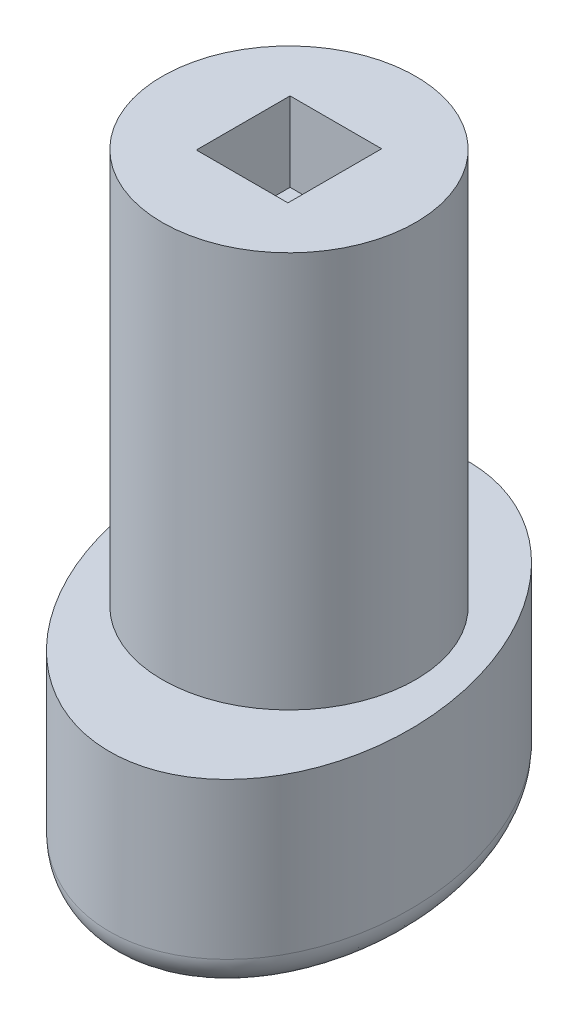
from build123d import *

# Parameters (mm, degrees)
SKETCH1_RX          = 3.556
SKETCH1_RY          = 2.54
BOSS_EXTRUDE1_DEPTH = 3
SKETCH2_R           = 2.032
BOSS_EXTRUDE2_DEPTH = 6.35
SKETCH3_W           = 1.468765614
SKETCH3_H           = 1.503189808
CUT_EXTRUDE1_DEPTH  = 1.27
FILLET1_R           = 0.5


with BuildPart() as part:
    # Sketch1 → Boss-Extrude1 (new body)
    with BuildSketch(Plane(origin=(0, 0, 0), x_dir=(1, 0, 0), z_dir=(0, 1, 0))):
        with Locations(Location((0, 0), (0, 0, 109.894492076))):
            Ellipse(SKETCH1_RX, SKETCH1_RY)
    extrude(amount=BOSS_EXTRUDE1_DEPTH)

    # Sketch2 → Boss-Extrude2 (add)
    with BuildSketch(Plane(origin=(0, 3, 0), x_dir=(1, 0, 0), z_dir=(0, 1, 0))):
        with Locations(Location((0, 0, 0), (0, 0, 270))):
            Circle(SKETCH2_R)
    extrude(amount=BOSS_EXTRUDE2_DEPTH)

    # Sketch3 → Cut-Extrude1 (cut)
    with BuildSketch(Plane(origin=(0, 9.35, 0), x_dir=(1, 0, 0), z_dir=(0, 1, 0))):
        Rectangle(SKETCH3_W, SKETCH3_H)
    extrude(amount=-CUT_EXTRUDE1_DEPTH, mode=Mode.SUBTRACT)

    # Fillet1
    fillet1_edges = [part.edges().sort_by_distance(p)[0] for p in [
        (1.211452415, 0, 3.343279373),
    ]]
    fillet(fillet1_edges, radius=FILLET1_R)


solid = part.part
